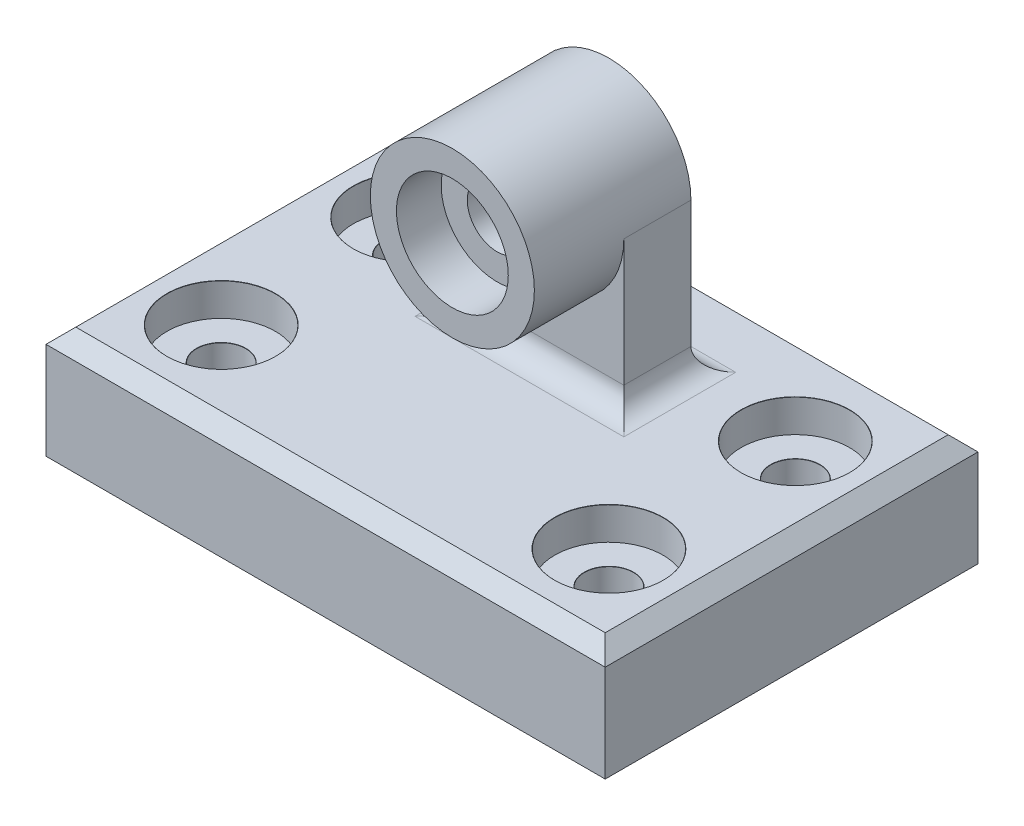
from build123d import *

# Parameters (mm, degrees)
SKETCH1_W            = 75
SKETCH1_H            = 50
BOSS_EXTRUDE1_DEPTH  = 15
CHAMFER1_SIZE        = 2
SKETCH2_W            = 22
SKETCH2_H            = 9
BOSS_EXTRUDE2_DEPTH  = 20
SKETCH3_R            = 11
BOSS_EXTRUDE3_DEPTH  = 21
SKETCH4_R            = 4
CUT_EXTRUDE2_DEPTH   = 94.968079687
SKETCH4_4_R          = 7.5
SKETCH4_4_R_2        = 4
CUT_EXTRUDE3_DEPTH   = 6
FILLET1_R            = 3
LPATTERN2_COUNT      = 2
LPATTERN2_PITCH      = 52
LPATTERN2_COUNT_DIR2 = 2
LPATTERN2_PITCH_DIR2 = 25


with BuildPart() as part:
    # Sketch1 → Boss-Extrude1 (new body)
    with BuildSketch(Plane(origin=(0, 0, 0), x_dir=(1, 0, 0), z_dir=(0, 1, 0))):
        with Locations((37.5, 25)):
            Rectangle(SKETCH1_W, SKETCH1_H)
    extrude(amount=BOSS_EXTRUDE1_DEPTH)

    # Chamfer1
    chamfer1_edges = [part.edges().sort_by_distance(p)[0] for p in [
        (75, 15, -25),
        (37.5, 15, -50),
        (0, 15, -25),
        (37.5, 15, 0),
    ]]
    chamfer(chamfer1_edges, length=CHAMFER1_SIZE)

    # Sketch2 → Boss-Extrude2 (add)
    with BuildSketch(Plane(origin=(0, 15, 0), x_dir=(1, 0, 0), z_dir=(0, 1, 0))):
        with Locations((37.5, 33.5)):
            Rectangle(SKETCH2_W, SKETCH2_H)
    extrude(amount=BOSS_EXTRUDE2_DEPTH)

    # Sketch3 → Boss-Extrude3 (add)
    with BuildSketch(Plane(origin=(0, 0, -38), x_dir=(-1, 0, 0), z_dir=(0, 0, -1))):
        with Locations((-37.5, 35)):
            Circle(SKETCH3_R)
    extrude(amount=-BOSS_EXTRUDE3_DEPTH)

    # Sketch4 → Cut-Extrude2 (cut, through all)
    with BuildSketch(Plane.XY.offset(-17)):
        with Locations((37.5, 35)):
            Circle(SKETCH4_R)
    extrude(amount=-CUT_EXTRUDE2_DEPTH, mode=Mode.SUBTRACT)

    # Sketch4<4> → Cut-Extrude3 (cut)
    with BuildSketch(Plane.XY.offset(-17)):
        with Locations((37.5, 35)):
            Circle(SKETCH4_4_R)
        with Locations((37.5, 35)):
            Circle(SKETCH4_4_R_2, mode=Mode.SUBTRACT)
    extrude(amount=-CUT_EXTRUDE3_DEPTH, mode=Mode.SUBTRACT)

    # Fillet1
    fillet1_edges = [part.edges().sort_by_distance(p)[0] for p in [
        (26.5, 15, -33.5),
        (37.5, 15, -38),
        (48.5, 15, -33.5),
        (37.5, 15, -29),
    ]]
    fillet(fillet1_edges, radius=FILLET1_R)

    # Sketch10 → CBORE for M6 Hex Head Bolt2 (revolve, cut)
    with BuildSketch(Plane(origin=(63.5, 15, -37), x_dir=(0, 0, 1), z_dir=(1, 0, 0))):
        Polygon((0, 0), (0, 15), (3.3, 15), (3.3, 4.405), (3.325, 4.38), (7.275, 4.38), (7.275, 0.025), (7.3, 0), align=None)
    cbore_for_m6_hex_head_bolt2 = revolve(axis=Axis((63.5, 21.35, -37), (0, -1, 0)), mode=Mode.SUBTRACT)

    # LPattern2: CBORE for M6 Hex Head Bolt2 2 × 2
    with Locations(*[(-i * LPATTERN2_PITCH, 0, j * LPATTERN2_PITCH_DIR2) for i in range(LPATTERN2_COUNT) for j in range(LPATTERN2_COUNT_DIR2) if (i, j) != (0, 0)]):
        add(cbore_for_m6_hex_head_bolt2, mode=Mode.SUBTRACT)


solid = part.part
